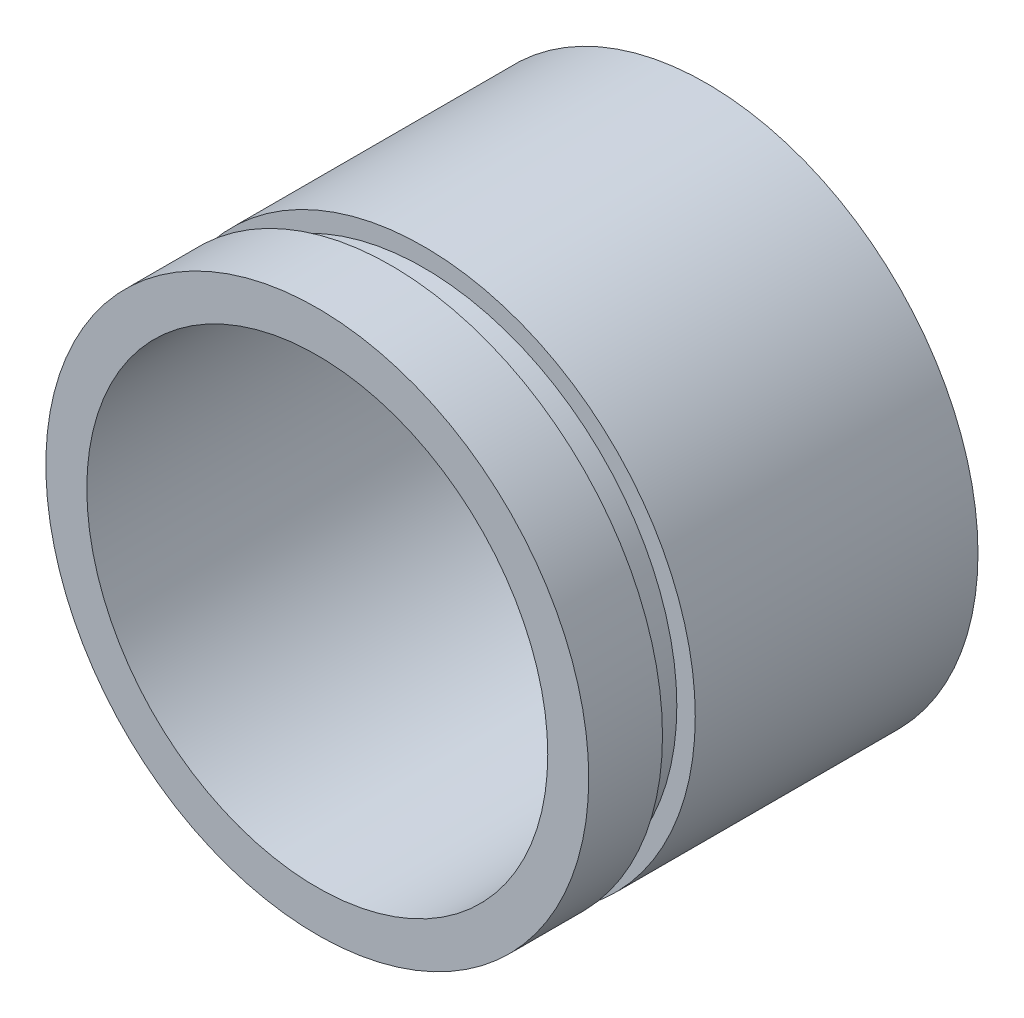
from build123d import *

# Parameters (mm, degrees)
SKETCH1_R           = 26.5
BOSS_EXTRUDE1_DEPTH = 19
SHELL1_T            = -4
SKETCH3_W           = 1.8
SKETCH3_H           = 3.2


with BuildPart() as part:
    # Sketch1 → Boss-Extrude1 (new, symmetric)
    with BuildSketch(Plane.XY):
        Circle(SKETCH1_R)
    extrude(amount=BOSS_EXTRUDE1_DEPTH, both=True)

    # Shell1
    shell1_openings = [part.faces().sort_by_distance(p)[0] for p in [
        (0, 0, 19),
    ]]
    offset(amount=SHELL1_T, openings=shell1_openings, kind=Kind.INTERSECTION)

    # Sketch3 → Cut-Revolve1 (revolve, cut)
    with BuildSketch(Plane(origin=(0, 0, 0), x_dir=(1, 0, 0), z_dir=(0, 1, 0))):
        with Locations((25.6, -10.2)):
            Rectangle(SKETCH3_W, SKETCH3_H)
    revolve(axis=Axis((0, 0, 19), (0, 0, -1)), mode=Mode.SUBTRACT)


solid = part.part
